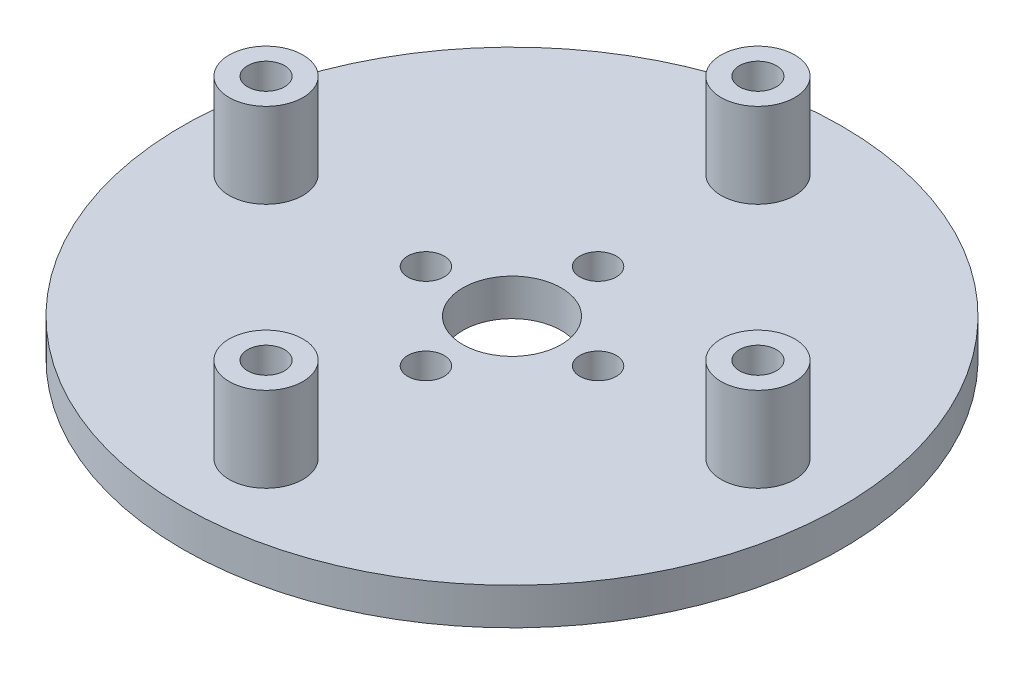
from build123d import *

# Parameters (mm, degrees)
SKETCH_1_R          = 26.8
SKETCH_1_R_2        = 4
SKETCH_1_R_3        = 1.48
SKETCH_1_R_4        = 1.5
EXTRUDE_1_DEPTH     = 3
SKETCH_2_R          = 3
SKETCH_2_R_2        = 1.5
EXTRUDE_2_DEPTH     = 6.9
SKETCH_3_R          = 3
CUT_EXTRUDE_1_DEPTH = 2


with BuildPart() as part:
    # 草图1 → 凸台-拉伸1 (new body)
    with BuildSketch(Plane(origin=(0, 0, 0), x_dir=(1, 0, 0), z_dir=(0, 1, 0))):
        with Locations(Location((0, 0, 0), (0, 0, 270))):
            Circle(SKETCH_1_R)
        with Locations(Location((0, 0, 0), (0, 0, 270))):
            Circle(SKETCH_1_R_2, mode=Mode.SUBTRACT)
        with Locations(Location((0, 7, 0), (0, 0, 270))):
            Circle(SKETCH_1_R_3, mode=Mode.SUBTRACT)
        with Locations(Location((0, 20, 0), (0, 0, 270))):
            Circle(SKETCH_1_R_4, mode=Mode.SUBTRACT)
        with Locations(Location((0, -7, 0), (0, 0, 270))):
            Circle(SKETCH_1_R_3, mode=Mode.SUBTRACT)
        with Locations(Location((7, 0, 0), (0, 0, 270))):
            Circle(SKETCH_1_R_3, mode=Mode.SUBTRACT)
        with Locations(Location((20, 0, 0), (0, 0, 270))):
            Circle(SKETCH_1_R_4, mode=Mode.SUBTRACT)
        with Locations(Location((0, -20, 0), (0, 0, 270))):
            Circle(SKETCH_1_R_4, mode=Mode.SUBTRACT)
        with Locations(Location((-20, 0, 0), (0, 0, 270))):
            Circle(SKETCH_1_R_4, mode=Mode.SUBTRACT)
        with Locations(Location((-7, 0, 0), (0, 0, 270))):
            Circle(SKETCH_1_R_3, mode=Mode.SUBTRACT)
    extrude(amount=EXTRUDE_1_DEPTH)

    # 草图2 → 凸台-拉伸2 (add)
    # profile 1 of 4: a face of its own
    with BuildSketch(Plane(origin=(0, 3, 0), x_dir=(1, 0, 0), z_dir=(0, 1, 0))):
        with Locations(Location((0, 20, 0), (0, 0, 90))):
            Circle(SKETCH_2_R)
        with Locations(Location((0, 20, 0), (0, 0, 270))):
            Circle(SKETCH_2_R_2, mode=Mode.SUBTRACT)
    # profile 2 of 4: a face of its own
    with BuildSketch(Plane(origin=(0, 3, 0), x_dir=(1, 0, 0), z_dir=(0, 1, 0))):
        with Locations(Location((-20, 0, 0), (0, 0, 90))):
            Circle(SKETCH_2_R)
        with Locations(Location((-20, 0, 0), (0, 0, 270))):
            Circle(SKETCH_2_R_2, mode=Mode.SUBTRACT)
    # profile 3 of 4: a face of its own
    with BuildSketch(Plane(origin=(0, 3, 0), x_dir=(1, 0, 0), z_dir=(0, 1, 0))):
        with Locations(Location((20, 0, 0), (0, 0, 90))):
            Circle(SKETCH_2_R)
        with Locations(Location((20, 0, 0), (0, 0, 270))):
            Circle(SKETCH_2_R_2, mode=Mode.SUBTRACT)
    # profile 4 of 4: a face of its own
    with BuildSketch(Plane(origin=(0, 3, 0), x_dir=(1, 0, 0), z_dir=(0, 1, 0))):
        with Locations(Location((0, -20, 0), (0, 0, 90))):
            Circle(SKETCH_2_R)
        with Locations(Location((0, -20, 0), (0, 0, 270))):
            Circle(SKETCH_2_R_2, mode=Mode.SUBTRACT)
    extrude(amount=EXTRUDE_2_DEPTH)

    # 草图3 → 切除-拉伸1 (cut)
    with BuildSketch(Plane.XZ):
        with Locations(Location((0, 20, 0), (0, 0, 270))):
            Circle(SKETCH_3_R)
        with Locations(Location((-20, 0, 0), (0, 0, 270))):
            Circle(SKETCH_3_R)
        with Locations(Location((0, -20, 0), (0, 0, 270))):
            Circle(SKETCH_3_R)
        with Locations(Location((20, 0, 0), (0, 0, 270))):
            Circle(SKETCH_3_R)
    extrude(amount=-CUT_EXTRUDE_1_DEPTH, mode=Mode.SUBTRACT)


solid = part.part
